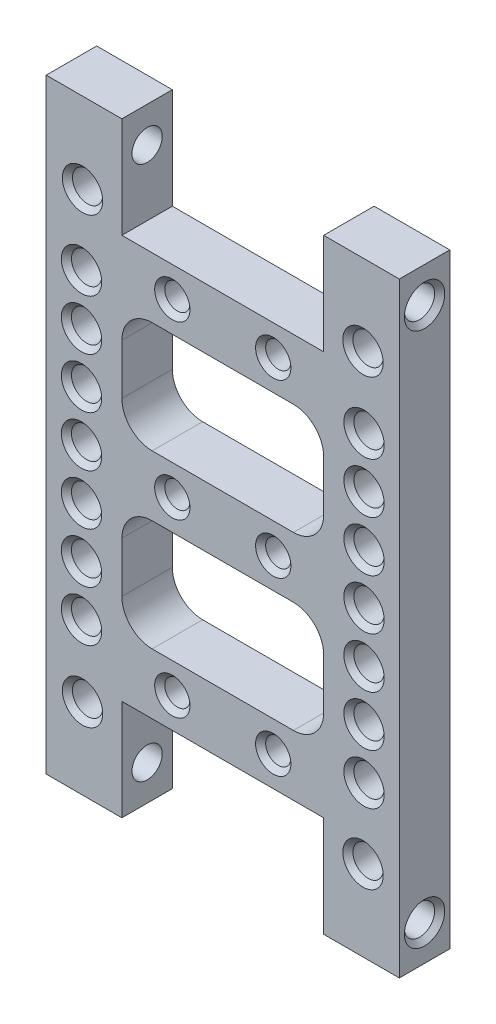
from build123d import *

# Parameters (mm, degrees)
SKETCH_1_W          = 35
SKETCH_1_H          = 60
EXTRUDE_1_DEPTH     = 5
SKETCH_2_R          = 1.5
SKETCH_2_R_2        = 0.5
SKETCH_2_W          = 20
SKETCH_2_H          = 10
CUT_EXTRUDE_1_DEPTH = 36.089172119
SKETCH_3_R          = 1.5
CUT_EXTRUDE_2_DEPTH = 47.368092477
HOLE_WIZARD_M3_1_D  = 2.5
CHAMFER_1_SIZE      = 0.5


with BuildPart() as part:
    # 草图1 → 凸台-拉伸1 (new body)
    with BuildSketch(Plane.XY):
        Rectangle(SKETCH_1_W, SKETCH_1_H)
    extrude(amount=EXTRUDE_1_DEPTH)

    # 草图2 → 切除-拉伸1 (cut, through all)
    with BuildSketch(Plane.XY.offset(5)):
        with Locations((-14, 0)):
            Circle(SKETCH_2_R)
        with Locations((-14, -15)):
            Circle(SKETCH_2_R)
        with Locations(Location((14, -15, 0), (0, 0, 180))):
            Circle(SKETCH_2_R)
        with Locations(Location((14, 0, 0), (0, 0, 180))):
            Circle(SKETCH_2_R)
        with Locations((-14, -10)):
            Circle(SKETCH_2_R)
        with Locations((-13.9, -22)):
            Circle(SKETCH_2_R)
        with Locations(Location((13.9, -22, 0), (0, 0, 180))):
            Circle(SKETCH_2_R)
        with Locations(Location((14, -10, 0), (0, 0, 180))):
            Circle(SKETCH_2_R)
        with Locations(Location((-13.9, 22, 0), (0, 0, 180))):
            Circle(SKETCH_2_R)
        with Locations((13.9, 22)):
            Circle(SKETCH_2_R)
        with Locations((14, 10)):
            Circle(SKETCH_2_R)
        with Locations(Location((-14, 10, 0), (0, 0, 180))):
            Circle(SKETCH_2_R)
        with Locations((14, 15)):
            Circle(SKETCH_2_R)
        with Locations(Location((-14, 15, 0), (0, 0, 180))):
            Circle(SKETCH_2_R)
        with Locations((-5, 0)):
            Circle(SKETCH_2_R_2)
        with Locations((5, 0)):
            Circle(SKETCH_2_R_2)
        with Locations((-14, -5)):
            Circle(SKETCH_2_R)
        with Locations(Location((14, -5, 0), (0, 0, 180))):
            Circle(SKETCH_2_R)
        with Locations((14, 5)):
            Circle(SKETCH_2_R)
        with Locations(Location((-14, 5, 0), (0, 0, 180))):
            Circle(SKETCH_2_R)
        with Locations((-5, 17)):
            Circle(SKETCH_2_R_2)
        with Locations((5, 17)):
            Circle(SKETCH_2_R_2)
        with Locations(Location((5, -17, 0), (0, 0, 180))):
            Circle(SKETCH_2_R_2)
        with Locations(Location((-5, -17, 0), (0, 0, 180))):
            Circle(SKETCH_2_R_2)
        with Locations((0, 25)):
            Rectangle(SKETCH_2_W, SKETCH_2_H)
        with Locations((0, -25)):
            Rectangle(SKETCH_2_W, SKETCH_2_H)
        with BuildLine():
            Line((10, 11), (10, 6))
            ThreePointArc((10, 6), (9.121320344, 3.878679656), (7, 3))
            Line((7, 3), (-7, 3))
            ThreePointArc((-7, 3), (-9.121320344, 3.878679656), (-10, 6))
            Line((-10, 6), (-10, 11))
            ThreePointArc((-10, 11), (-9.121320344, 13.121320344), (-7, 14))
            Line((-7, 14), (7, 14))
            ThreePointArc((7, 14), (9.121320344, 13.121320344), (10, 11))
        make_face()
        with BuildLine():
            Line((-7, -14), (7, -14))
            ThreePointArc((7, -14), (9.121320344, -13.121320344), (10, -11))
            Line((10, -11), (10, -6))
            ThreePointArc((10, -6), (9.121320344, -3.878679656), (7, -3))
            Line((7, -3), (-7, -3))
            ThreePointArc((-7, -3), (-9.121320344, -3.878679656), (-10, -6))
            Line((-10, -6), (-10, -11))
            ThreePointArc((-10, -11), (-9.121320344, -13.121320344), (-7, -14))
        make_face()
    extrude(amount=-CUT_EXTRUDE_1_DEPTH, mode=Mode.SUBTRACT)

    # 草图3 → 切除-拉伸2 (cut, through all)
    with BuildSketch(Plane(origin=(17.5, 0, 0), x_dir=(0, 0, -1), z_dir=(1, 0, 0))):
        with Locations((-2.5, -26.5)):
            Circle(SKETCH_3_R)
        with Locations((-2.5, 26.5)):
            Circle(SKETCH_3_R)
    extrude(amount=-CUT_EXTRUDE_2_DEPTH, mode=Mode.SUBTRACT)

    # M3 螺纹孔1 (through all)
    with Locations(Plane.XY.offset(5)):
        with Locations((-5, 17), (5, 17), (-5, 0), (5, 0), (-5, -17), (5, -17)):
            Hole(HOLE_WIZARD_M3_1_D / 2)

    # 倒角1
    chamfer_1_edges = [part.edges().sort_by_distance(p)[0] for p in [
        (-15.5, -5, 0),
        (-15.5, -5, 5),
        (15.5, -5, 0),
        (15.5, -5, 5),
        (12.5, 5, 0),
        (12.5, 5, 5),
        (-12.5, 5, 0),
        (-12.5, 5, 5),
        (-17.5, -26.5, 4),
        (17.5, -26.5, 4),
        (-17.5, 26.5, 4),
        (17.5, 26.5, 4),
        (6.25, -17, 5),
        (6.25, -17, 0),
        (-3.75, -17, 5),
        (-3.75, -17, 0),
        (6.25, 0, 5),
        (6.25, 0, 0),
        (-3.75, 0, 5),
        (-3.75, 0, 0),
        (6.25, 17, 5),
        (6.25, 17, 0),
        (-3.75, 17, 5),
        (-3.75, 17, 0),
        (-15.5, 0, 0),
        (-15.5, 0, 5),
        (-15.5, -15, 0),
        (-15.5, -15, 5),
        (15.5, -15, 0),
        (15.5, -15, 5),
        (15.5, 0, 0),
        (15.5, 0, 5),
        (-15.5, -10, 0),
        (-15.5, -10, 5),
        (-15.4, -22, 0),
        (-15.4, -22, 5),
        (15.4, -22, 0),
        (15.4, -22, 5),
        (15.5, -10, 0),
        (15.5, -10, 5),
        (-12.4, 22, 0),
        (-12.4, 22, 5),
        (12.4, 22, 0),
        (12.4, 22, 5),
        (12.5, 10, 0),
        (12.5, 10, 5),
        (-12.5, 10, 0),
        (-12.5, 10, 5),
        (12.5, 15, 5),
        (-12.5, 15, 0),
        (-12.5, 15, 5),
    ]]
    chamfer(chamfer_1_edges, length=CHAMFER_1_SIZE)


solid = part.part
